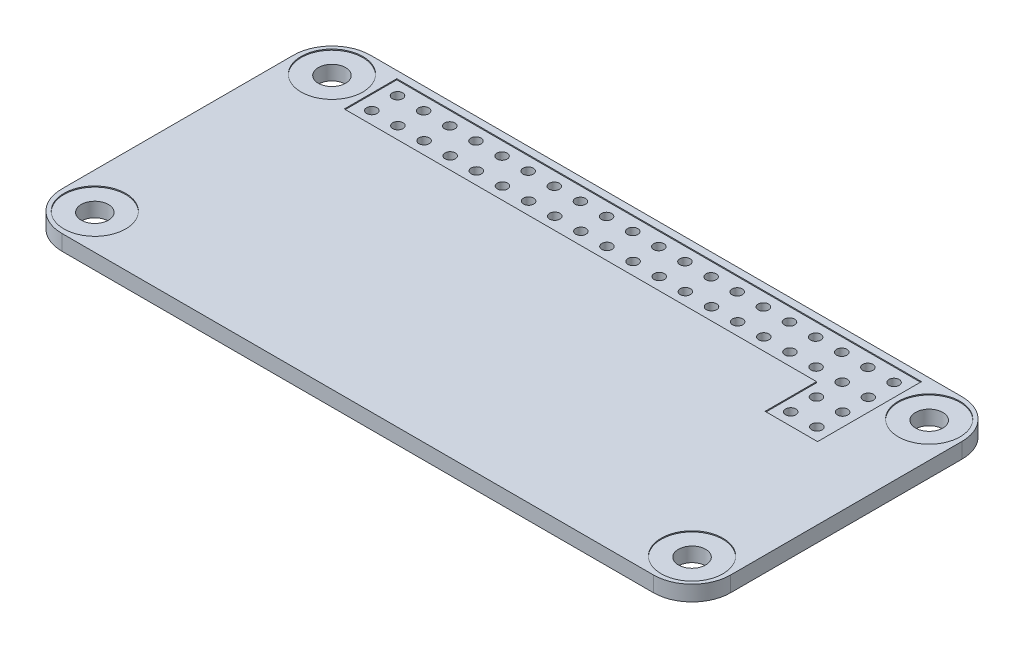
from build123d import *

# Parameters (mm, degrees)
BOSS_EXTRUDE1_DEPTH = 1.5
SKETCH2_R           = 1.325
CUT_EXTRUDE1_DEPTH  = 36.825968235
SKETCH3_R           = 0.5
CUT_EXTRUDE2_DEPTH  = 36.825968235
LPATTERN1_COUNT     = 20
LPATTERN1_PITCH     = 2.54
SKETCH5_R           = 0.5
CUT_EXTRUDE4_DEPTH  = 36.825968235
SKETCH4_R           = 3
CUT_EXTRUDE3_DEPTH  = 0.1


with BuildPart() as part:
    # Sketch1 → Boss-Extrude1 (new body)
    with BuildSketch(Plane(origin=(0, 0, 0), x_dir=(1, 0, 0), z_dir=(0, 1, 0))):
        with BuildLine():
            Line((-28.75, 15), (28.75, 15))
            ThreePointArc((28.75, 15), (31.401650429, 13.901650429), (32.5, 11.25))
            Line((32.5, 11.25), (32.5, -11.25))
            ThreePointArc((32.5, -11.25), (31.401650429, -13.901650429), (28.75, -15))
            Line((28.75, -15), (-28.75, -15))
            ThreePointArc((-28.75, -15), (-31.401650429, -13.901650429), (-32.5, -11.25))
            Line((-32.5, -11.25), (-32.5, 11.25))
            ThreePointArc((-32.5, 11.25), (-31.401650429, 13.901650429), (-28.75, 15))
        make_face()
    extrude(amount=BOSS_EXTRUDE1_DEPTH)

    # Sketch2 → Cut-Extrude1 (cut, through all)
    with BuildSketch(Plane(origin=(0, 1.5, 0), x_dir=(1, 0, 0), z_dir=(0, 1, 0))):
        with Locations(Location((-29.025, 11.525, 0), (0, 0, 270))):
            Circle(SKETCH2_R)
        with Locations(Location((29.025, 11.525, 0), (0, 0, 90))):
            Circle(SKETCH2_R)
        with Locations(Location((29.025, -11.525, 0), (0, 0, 270))):
            Circle(SKETCH2_R)
        with Locations(Location((-29.025, -11.525, 0), (0, 0, 90))):
            Circle(SKETCH2_R)
    extrude(amount=-CUT_EXTRUDE1_DEPTH, mode=Mode.SUBTRACT)

    # Sketch3 → Cut-Extrude2 (cut, through all)
    with BuildSketch(Plane(origin=(0, 1.5, 0), x_dir=(1, 0, 0), z_dir=(0, 1, 0))):
        with Locations(Location((-24.128, 13, 0), (0, 0, 270))):
            Circle(SKETCH3_R)
        with Locations(Location((-24.128, 10.5, 0), (0, 0, 270))):
            Circle(SKETCH3_R)
    cut_extrude2 = extrude(amount=-CUT_EXTRUDE2_DEPTH, mode=Mode.SUBTRACT)

    # LPattern1: Cut-Extrude2 ×20
    with Locations(*[(i * LPATTERN1_PITCH, 0, 0) for i in range(1, LPATTERN1_COUNT)]):
        add(cut_extrude2, mode=Mode.SUBTRACT)

    # Sketch5 → Cut-Extrude4 (cut, through all)
    with BuildSketch(Plane(origin=(0, 1.5, 0), x_dir=(1, 0, 0), z_dir=(0, 1, 0))):
        with Locations(Location((21.592, 5.5, 0), (0, 0, 270))):
            Circle(SKETCH5_R)
        with Locations(Location((24.132, 5.5, 0), (0, 0, 270))):
            Circle(SKETCH5_R)
        with Locations(Location((21.592, 8, 0), (0, 0, 270))):
            Circle(SKETCH5_R)
        with Locations(Location((24.132, 8, 0), (0, 0, 270))):
            Circle(SKETCH5_R)
    extrude(amount=-CUT_EXTRUDE4_DEPTH, mode=Mode.SUBTRACT)

    # Sketch4 → Cut-Extrude3 (cut)
    with BuildSketch(Plane(origin=(0, 1.5, 0), x_dir=(1, 0, 0), z_dir=(0, 1, 0))):
        with Locations(Location((-29.025, 11.525, 0), (0, 0, 270))):
            Circle(SKETCH4_R)
        with Locations(Location((-29.025, -11.525, 0), (0, 0, 270))):
            Circle(SKETCH4_R)
        with Locations(Location((29.025, -11.525, 0), (0, 0, 270))):
            Circle(SKETCH4_R)
        with Locations(Location((29.025, 11.525, 0), (0, 0, 270))):
            Circle(SKETCH4_R)
        Polygon((-25.5, 14.3), (25.5, 14.3), (25.5, 9.2), (25.5, 4.2), (20.4, 4.2), (20.4, 9.2), (-25.5, 9.2), align=None)
    extrude(amount=-CUT_EXTRUDE3_DEPTH, mode=Mode.SUBTRACT)


solid = part.part
